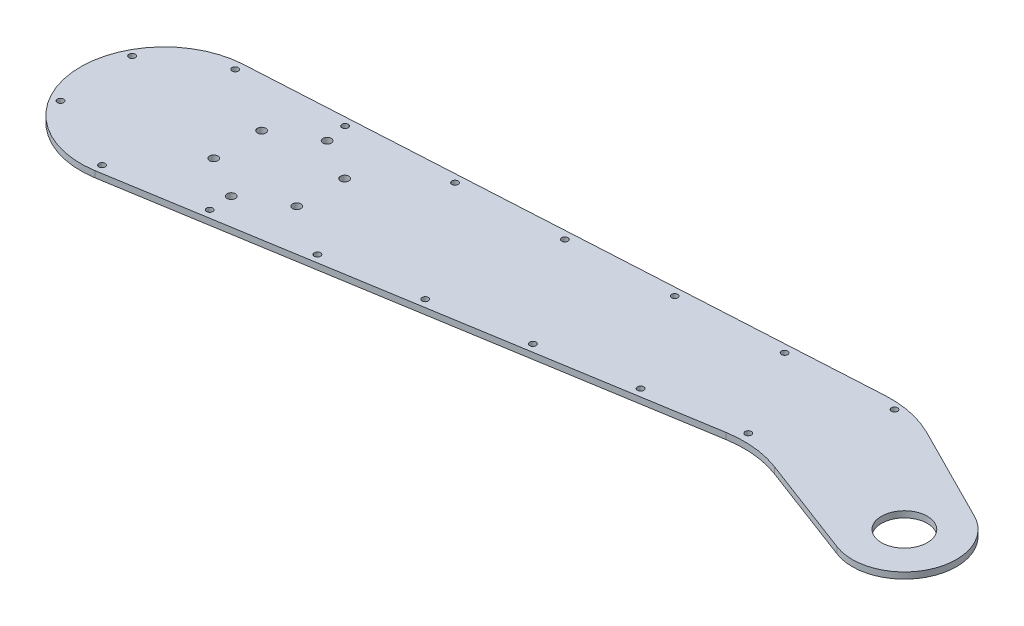
from build123d import *

# Parameters (mm, degrees)
SKETCH1_R           = 2
SKETCH1_R_2         = 11
BOSS_EXTRUDE2_DEPTH = 3
FILLET1_R           = 50
SKETCH2_R           = 1.5
CUT_EXTRUDE1_DEPTH  = 10


with BuildPart() as part:
    # Sketch1 → Boss-Extrude2 (new body)
    with BuildSketch(Plane(origin=(0, 0, 0), x_dir=(1, 0, 0), z_dir=(0, 1, 0))):
        with BuildLine():
            Line((-43.210033531, -45.078612162), (230.077464987, -0.308197366))
            Line((230.077464987, -0.308197366), (291.16461822, -23.386663481))
            ThreePointArc((291.16461822, -23.386663481), (322.884028765, -10.065844598), (311.267854408, 22.316708024))
            Line((311.267854408, 22.316708024), (252.97547919, 51.748916229))
            Line((252.97547919, 51.748916229), (-51.951129031, 34.644890888))
            ThreePointArc((-51.951129031, 34.644890888), (-89.620314745, -9.826208081), (-43.210033531, -45.078612162))
        make_face()
        with Locations(Location((19.918584287, -11.5, 0), (0, 0, 270))):
            Circle(SKETCH1_R, mode=Mode.SUBTRACT)
        with Locations(Location((0, -23, 0), (0, 0, 270))):
            Circle(SKETCH1_R, mode=Mode.SUBTRACT)
        with Locations(Location((-19.918584287, -11.5, 0), (0, 0, 270))):
            Circle(SKETCH1_R, mode=Mode.SUBTRACT)
        with Locations(Location((-19.918584287, 11.5, 0), (0, 0, 270))):
            Circle(SKETCH1_R, mode=Mode.SUBTRACT)
        with Locations(Location((0, 23, 0), (0, 0, 270))):
            Circle(SKETCH1_R, mode=Mode.SUBTRACT)
        with Locations(Location((19.918584287, 11.5, 0), (0, 0, 270))):
            Circle(SKETCH1_R, mode=Mode.SUBTRACT)
        with Locations(Location((300, 0, 0), (0, 0, 270))):
            Circle(SKETCH1_R_2, mode=Mode.SUBTRACT)
    extrude(amount=BOSS_EXTRUDE2_DEPTH)

    # Fillet1
    fillet1_edges = [part.edges().sort_by_distance(p)[0] for p in [
        (252.97547919, 1.5, -51.748916229),
        (230.077464987, 1.5, 0.308197366),
    ]]
    fillet(fillet1_edges, radius=FILLET1_R)

    # Sketch2 → Cut-Extrude1 (cut)
    with BuildSketch(Plane(origin=(0, 3, 0), x_dir=(1, 0, 0), z_dir=(0, 1, 0))):
        with Locations(Location((-51.727112095, 30.651168763, 0), (0, 0, 270))):
            Circle(SKETCH2_R)
        with Locations(Location((-43.856700198, -41.13123047, 0), (0, 0, 270))):
            Circle(SKETCH2_R)
        with Locations(Location((-80.543038085, -24.356685052, 0), (0, 0, 270))):
            Circle(SKETCH2_R)
        with Locations(Location((-82.014474694, 11.465683169, 0), (0, 0, 270))):
            Circle(SKETCH2_R)
        with Locations(Location((-1.805585532, 33.451380461, 0), (0, 0, 270))):
            Circle(SKETCH2_R)
        with Locations(Location((48.115941032, 36.251592159, 0), (0, 0, 270))):
            Circle(SKETCH2_R)
        with Locations(Location((98.037467596, 39.051803857, 0), (0, 0, 270))):
            Circle(SKETCH2_R)
        with Locations(Location((147.958994159, 41.852015556, 0), (0, 0, 270))):
            Circle(SKETCH2_R)
        with Locations(Location((197.880520723, 44.652227254, 0), (0, 0, 270))):
            Circle(SKETCH2_R)
        with Locations(Location((247.802047287, 47.452438952, 0), (0, 0, 270))):
            Circle(SKETCH2_R)
        with Locations(Location((0.551343837, -33.85623047, 0), (0, 0, 270))):
            Circle(SKETCH2_R)
        with Locations(Location((44.959387872, -26.58123047, 0), (0, 0, 270))):
            Circle(SKETCH2_R)
        with Locations(Location((89.367431907, -19.30623047, 0), (0, 0, 270))):
            Circle(SKETCH2_R)
        with Locations(Location((133.775475942, -12.03123047, 0), (0, 0, 270))):
            Circle(SKETCH2_R)
        with Locations(Location((178.183519977, -4.75623047, 0), (0, 0, 270))):
            Circle(SKETCH2_R)
        with Locations(Location((222.591564011, 2.51876953, 0), (0, 0, 270))):
            Circle(SKETCH2_R)
    extrude(amount=-CUT_EXTRUDE1_DEPTH, mode=Mode.SUBTRACT)


solid = part.part
